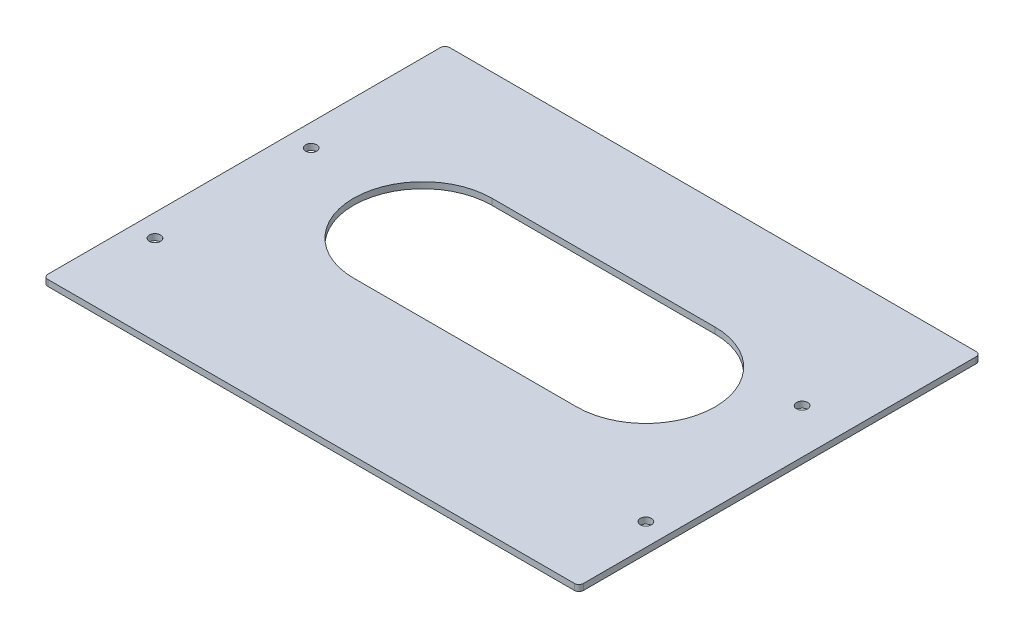
from build123d import *

# Parameters (mm, degrees)
BOSS_EXTRUDE1_DEPTH = 3.5
CUT_EXTRUDE7_DEPTH  = 289.878374321
SKETCH8_R           = 3.175
CUT_EXTRUDE8_DEPTH  = 289.878374321


with BuildPart() as part:
    # Sketch1 → Boss-Extrude1 (new body)
    with BuildSketch(Plane(origin=(0, 0, 0), x_dir=(1, 0, 0), z_dir=(0, 1, 0))):
        with BuildLine():
            Line((-126.953423408, -0.978024545), (172.766576592, -0.978024545))
            ThreePointArc((172.766576592, -0.978024545), (174.562627816, -1.721973321), (175.306576592, -3.518024545))
            Line((175.306576592, -3.518024545), (175.306576592, -227.038024545))
            ThreePointArc((175.306576592, -227.038024545), (174.562627816, -228.834075769), (172.766576592, -229.578024545))
            Line((172.766576592, -229.578024545), (-126.953423408, -229.578024545))
            ThreePointArc((-126.953423408, -229.578024545), (-128.749474632, -228.834075769), (-129.493423408, -227.038024545))
            Line((-129.493423408, -227.038024545), (-129.493423408, -3.518024545))
            ThreePointArc((-129.493423408, -3.518024545), (-128.749474632, -1.721973321), (-126.953423408, -0.978024545))
        make_face()
    extrude(amount=BOSS_EXTRUDE1_DEPTH)

    # Sketch7 → Cut-Extrude7 (cut, through all)
    with BuildSketch(Plane(origin=(0, 0, 0), x_dir=(-1, 0, 0), z_dir=(0, -1, 0))):
        with BuildLine():
            Line((40.593423408, -141.948024545), (-86.406576592, -141.948024545))
            ThreePointArc((-86.406576592, -141.948024545), (-125.776576592, -102.578024545), (-86.406576592, -63.208024545))
            Line((-86.406576592, -63.208024545), (40.593423408, -63.208024545))
            ThreePointArc((40.593423408, -63.208024545), (79.963423408, -102.578024545), (40.593423408, -141.948024545))
        make_face()
    extrude(amount=-CUT_EXTRUDE7_DEPTH, mode=Mode.SUBTRACT)

    # Sketch8 → Cut-Extrude8 (cut, through all)
    with BuildSketch(Plane(origin=(0, 0, 0), x_dir=(-1, 0, 0), z_dir=(0, -1, 0))):
        with Locations(Location((-149.906576592, -77.178024545, 0), (0, 0, 90))):
            Circle(SKETCH8_R)
        with Locations(Location((116.793423408, -89.878024545, 0), (0, 0, 90))):
            Circle(SKETCH8_R)
        with Locations(Location((116.793423408, -178.778024545, 0), (0, 0, 90))):
            Circle(SKETCH8_R)
        with Locations(Location((-162.606576592, -178.778024545, 0), (0, 0, 90))):
            Circle(SKETCH8_R)
    extrude(amount=-CUT_EXTRUDE8_DEPTH, mode=Mode.SUBTRACT)


solid = part.part
